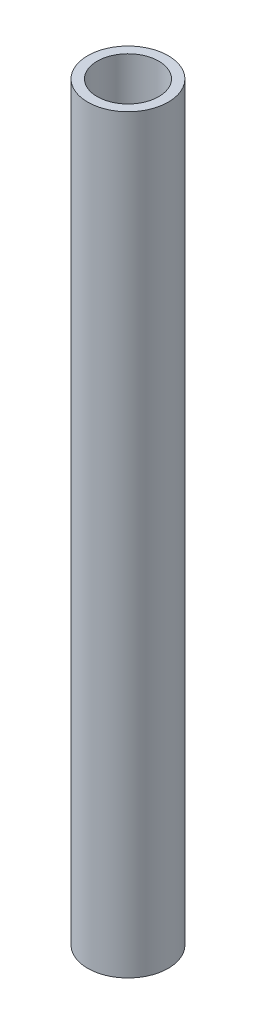
from build123d import *

# Parameters (mm, degrees)
SKETCH1_R    = 0.6477
SKETCH1_R_2  = 0.4953
NEEDLE_DEPTH = 12.065


with BuildPart() as part:
    # Sketch1 → Needle (new body)
    with BuildSketch(Plane(origin=(0, 0, 0), x_dir=(1, 0, 0), z_dir=(0, 1, 0))):
        Circle(SKETCH1_R)
        Circle(SKETCH1_R_2, mode=Mode.SUBTRACT)
    extrude(amount=-NEEDLE_DEPTH)


solid = part.part
